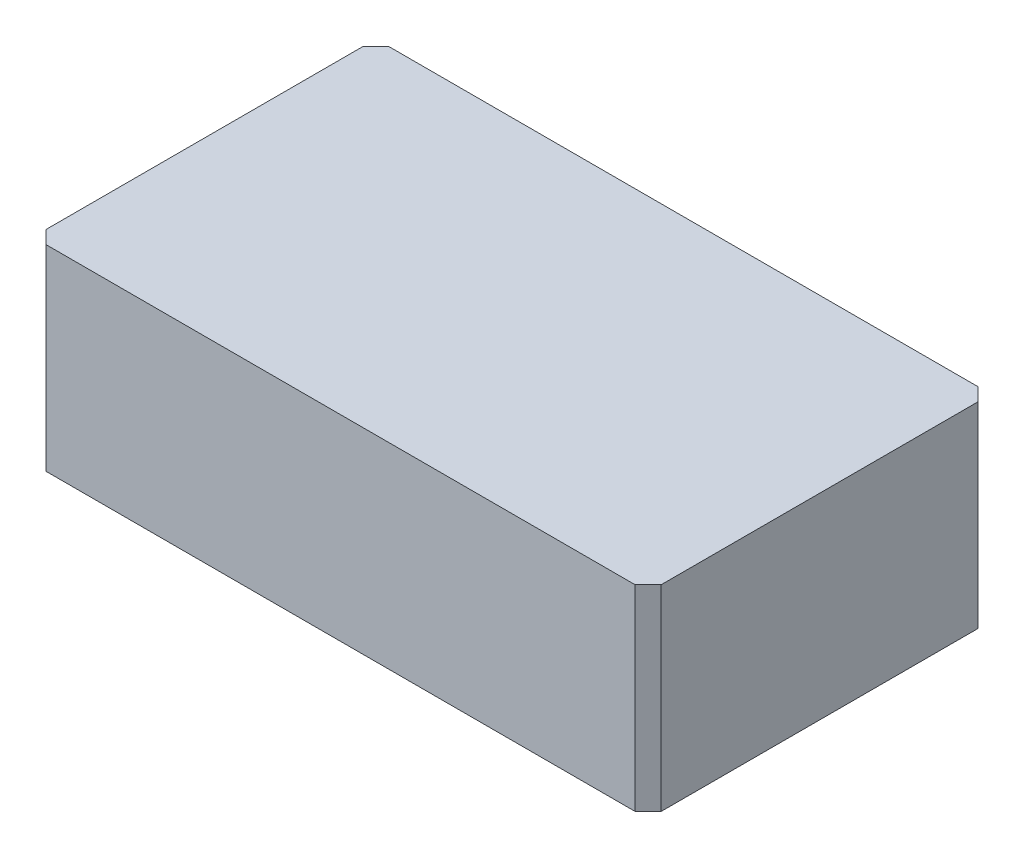
from build123d import *

# Parameters (mm, degrees)
SKETCH1_W           = 47
SKETCH1_H           = 15
BOSS_EXTRUDE1_DEPTH = 26.2
CHAMFER1_SIZE       = 1


with BuildPart() as part:
    # Sketch1 → Boss-Extrude1 (new body)
    with BuildSketch(Plane.XY):
        with Locations((3.796333003, -6.334489594)):
            Rectangle(SKETCH1_W, SKETCH1_H)
    extrude(amount=BOSS_EXTRUDE1_DEPTH)

    # Chamfer1
    chamfer1_edges = [part.edges().sort_by_distance(p)[0] for p in [
        (27.296333003, -6.334489594, 26.2),
        (-19.703666997, -6.334489594, 26.2),
        (27.296333003, -6.334489594, 0),
        (-19.703666997, -6.334489594, 0),
    ]]
    chamfer(chamfer1_edges, length=CHAMFER1_SIZE)


solid = part.part
